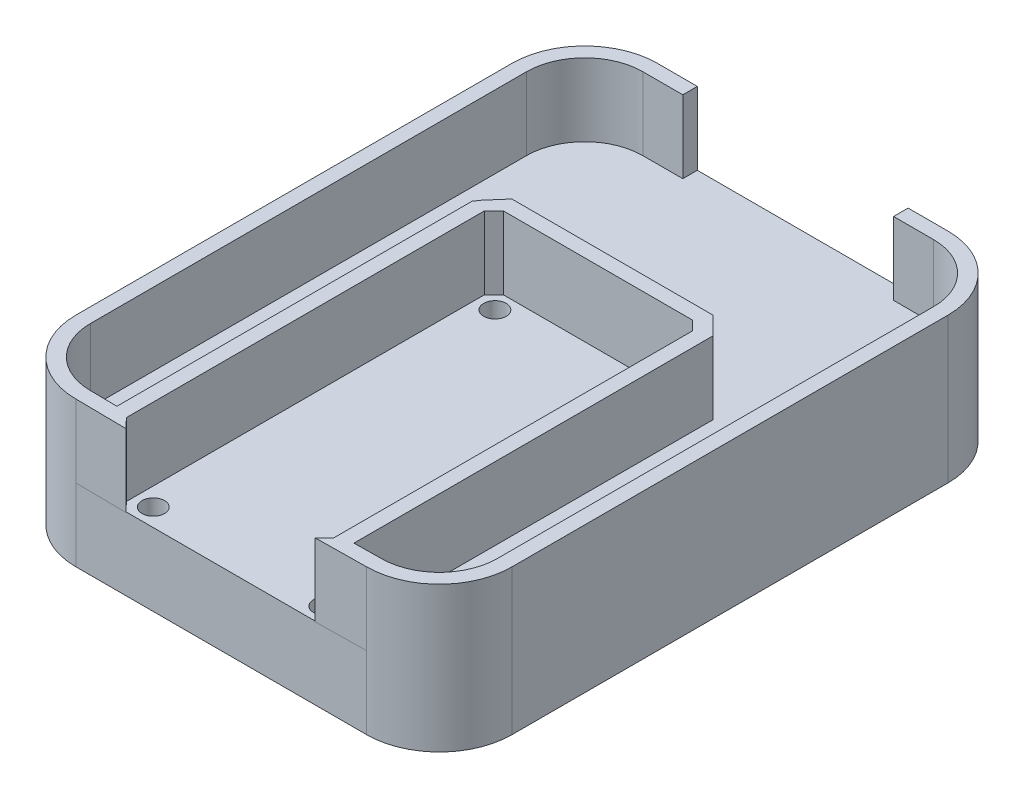
from build123d import *

# Parameters (mm, degrees)
SKETCH1_W           = 60
SKETCH1_H           = 80
BOSS_EXTRUDE1_DEPTH = 5
FILLET1_R           = 10
SKETCH3_R           = 1.55
CUT_EXTRUDE11_DEPTH = 10
BOSS_EXTRUDE2_DEPTH = 10
BOSS_EXTRUDE3_DEPTH = 10


with BuildPart() as part:
    # Sketch1 → Boss-Extrude1 (new, symmetric)
    with BuildSketch(Plane(origin=(0, 0, 0), x_dir=(1, 0, 0), z_dir=(0, 1, 0))):
        Rectangle(SKETCH1_W, SKETCH1_H)
    extrude(amount=BOSS_EXTRUDE1_DEPTH, both=True)

    # Fillet1
    fillet1_edges = [part.edges().sort_by_distance(p)[0] for p in [
        (-30, 0, -40),
        (30, 0, -40),
        (30, 0, 40),
        (-30, 0, 40),
    ]]
    fillet(fillet1_edges, radius=FILLET1_R)

    # Sketch3 → Cut-Extrude11 (cut)
    with BuildSketch(Plane(origin=(0, 5, 0), x_dir=(1, 0, 0), z_dir=(0, 1, 0))):
        with Locations(Location((-11.8, 9.45, 0), (0, 0, 270))):
            Circle(SKETCH3_R)
        with Locations(Location((11.8, 9.45, 0), (0, 0, 270))):
            Circle(SKETCH3_R)
        with Locations(Location((-11.8, -37.55, 0), (0, 0, 270))):
            Circle(SKETCH3_R)
        with Locations(Location((11.8, -37.55, 0), (0, 0, 270))):
            Circle(SKETCH3_R)
    extrude(amount=-CUT_EXTRUDE11_DEPTH, mode=Mode.SUBTRACT)

    # Sketch6 → Boss-Extrude2 (add)
    with BuildSketch(Plane(origin=(0, 5, 0), x_dir=(1, 0, 0), z_dir=(0, 1, 0))):
        with BuildLine():
            Line((30, -30), (30, 30))
            ThreePointArc((30, 30), (27.071067812, 37.071067812), (20, 40))
            Line((20, 40), (14.5, 40))
            Line((14.5, 40), (14.5, 38))
            Line((14.5, 38), (20, 38))
            ThreePointArc((20, 38), (25.656854249, 35.656854249), (28, 30))
            Line((28, 30), (28, -30))
            ThreePointArc((28, -30), (25.652656249, -35.661049137), (19.988130666, -37.999991195))
            Line((19.988130666, -37.999991195), (14.301118682, -38.071478623))
            Line((14.301118682, -38.071478623), (14.285233791, -38.789415009))
            Line((14.285233791, -38.789415009), (12.98648686, -40.088161941))
            Line((12.98648686, -40.088161941), (20, -40))
            ThreePointArc((20, -40), (27.071067812, -37.071067812), (30, -30))
        make_face()
        with BuildLine():
            Line((-30, 30), (-30, -30))
            ThreePointArc((-30, -30), (-27.071067812, -37.071067812), (-20, -40))
            Line((-20, -40), (-13.014230023, -40.088161941))
            Line((-13.014230023, -40.088161941), (-14.314872692, -38.748440589))
            Line((-14.314872692, -38.748440589), (-14.314872692, -38.071588283))
            Line((-14.314872692, -38.071588283), (-19.988083532, -37.999991125))
            ThreePointArc((-19.988083532, -37.999991125), (-25.652639572, -35.661065789), (-28, -30))
            Line((-28, -30), (-28, 30))
            ThreePointArc((-28, 30), (-25.656854249, 35.656854249), (-20, 38))
            Line((-20, 38), (-14.5, 38))
            Line((-14.5, 38), (-14.5, 40))
            Line((-14.5, 40), (-20, 40))
            ThreePointArc((-20, 40), (-27.071067812, 37.071067812), (-30, 30))
        make_face()
    extrude(amount=BOSS_EXTRUDE2_DEPTH)

    # Sketch5 → Boss-Extrude3 (add)
    with BuildSketch(Plane(origin=(0, 5, 0), x_dir=(1, 0, 0), z_dir=(0, 1, 0))):
        Polygon((14.285233791, -38.789415009), (14.3, 10.507634941), (12.98648686, 11.821148081), (-13.014230023, 11.821148081), (-14.31369616, 10.516205754), (-14.314872692, 10.512459037), (-14.314872692, -38.748440589), (-16.314872692, -38.748440589), (-16.314872692, 10.819094366), (-15.842590188, 11.515908447), (-13.84512164, 13.821148081), (13.814913984, 13.821148081), (16.300248159, 11.335813907), (16.300248159, -38.789415009), align=None)
    extrude(amount=BOSS_EXTRUDE3_DEPTH)


solid = part.part
